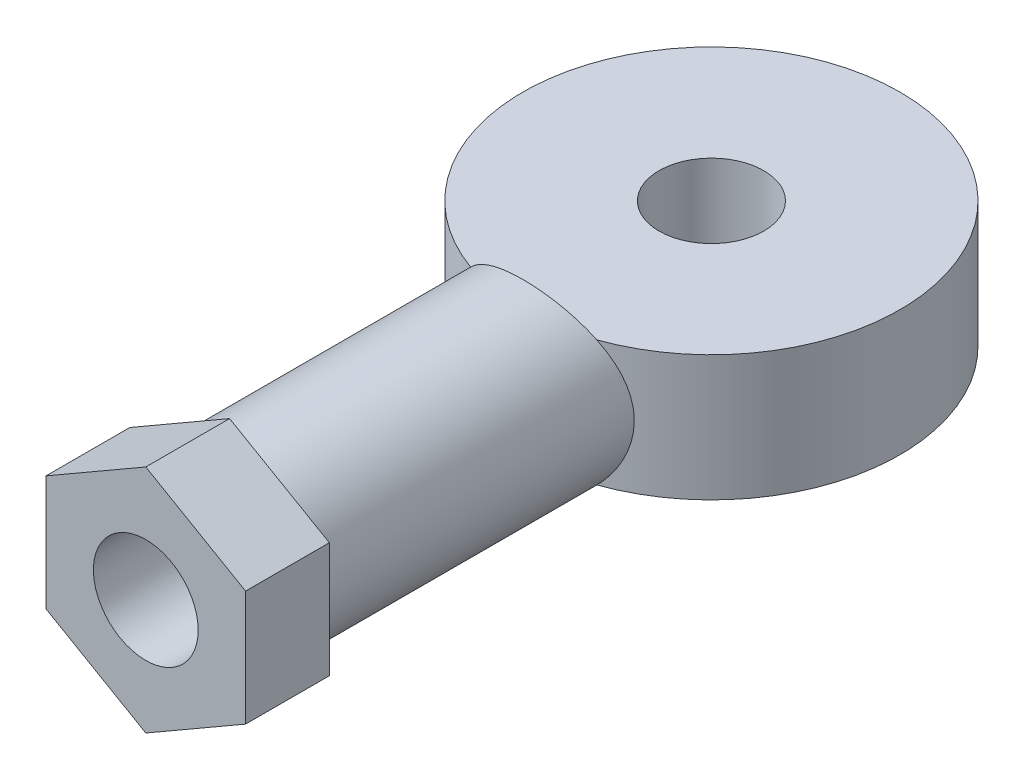
from build123d import *

# Parameters (mm, degrees)
SKETCH_1_R          = 9
SKETCH_1_R_2        = 2.5
EXTRUDE_1_DEPTH     = 6
SKETCH_2_R          = 4.25
EXTRUDE_2_DEPTH     = 18
SKETCH_3_R          = 9
CUT_EXTRUDE_1_DEPTH = 26.740289584
SKETCH_4_R          = 9
CUT_EXTRUDE_2_DEPTH = 26.740289584
EXTRUDE_3_DEPTH     = 4
SKETCH_6_R          = 2.5
CUT_EXTRUDE_3_DEPTH = 15


with BuildPart() as part:
    # 草图1 → 凸台-拉伸1 (new body)
    with BuildSketch(Plane(origin=(0, 0, 0), x_dir=(1, 0, 0), z_dir=(0, 1, 0))):
        with Locations(Location((0, 0, 0), (0, 0, 270))):
            Circle(SKETCH_1_R)
        with Locations(Location((0, 0, 0), (0, 0, 270))):
            Circle(SKETCH_1_R_2, mode=Mode.SUBTRACT)
    extrude(amount=EXTRUDE_1_DEPTH)

    # 草图2 → 凸台-拉伸2 (add)
    with BuildSketch(Plane.XY.offset(23)):
        with Locations((0, 3)):
            Circle(SKETCH_2_R)
    extrude(amount=-EXTRUDE_2_DEPTH)

    # 草图3 → 切除-拉伸1 (cut, through all)
    with BuildSketch(Plane(origin=(0, 6, 0), x_dir=(1, 0, 0), z_dir=(0, 1, 0))):
        Circle(SKETCH_3_R)
    extrude(amount=CUT_EXTRUDE_1_DEPTH, mode=Mode.SUBTRACT)

    # 草图4 → 切除-拉伸2 (cut, through all)
    with BuildSketch(Plane.XZ):
        Circle(SKETCH_4_R)
    extrude(amount=CUT_EXTRUDE_2_DEPTH, mode=Mode.SUBTRACT)

    # 草图5 → 凸台-拉伸3 (add)
    with BuildSketch(Plane.XY.offset(23)):
        Polygon((0, 8.5), (-4.763139721, 5.75), (-4.763139721, 0.25), (0, -2.5), (4.763139721, 0.25), (4.763139721, 5.75), align=None)
    extrude(amount=EXTRUDE_3_DEPTH)

    # 草图6 → 切除-拉伸3 (cut)
    with BuildSketch(Plane.XY.offset(27)):
        with Locations((0, 3)):
            Circle(SKETCH_6_R)
    extrude(amount=-CUT_EXTRUDE_3_DEPTH, mode=Mode.SUBTRACT)


solid = part.part
